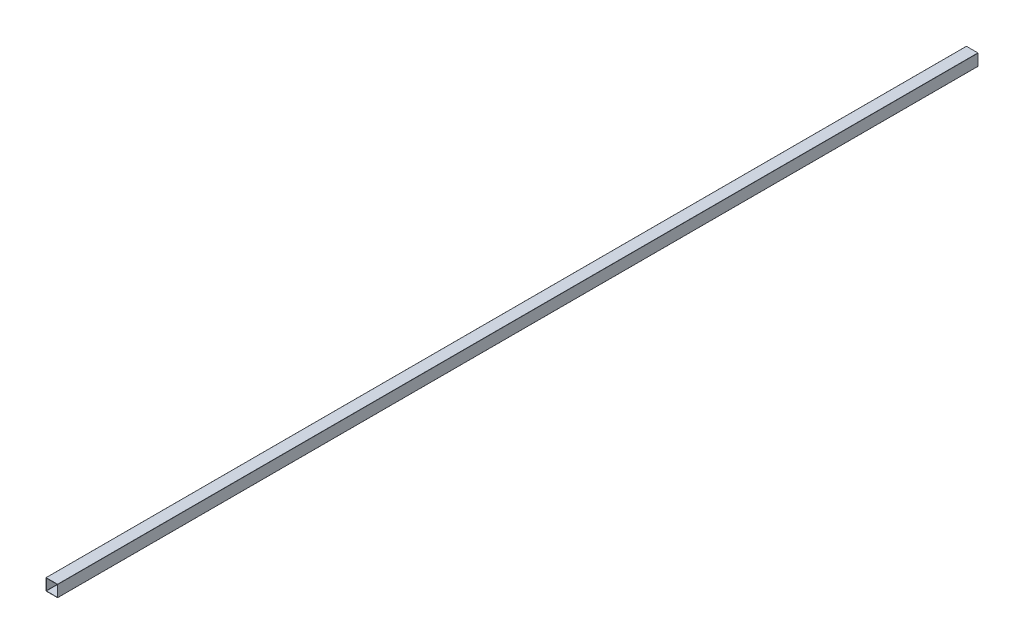
from build123d import *

# Parameters (mm, degrees)
CROQUIS1_W              = 76.2
CROQUIS1_H              = 76.2
CROQUIS1_W_2            = 72.42
CROQUIS1_H_2            = 72.42
SALIENTE_EXTRUIR1_DEPTH = 6000
REDONDEO1_R             = 1


with BuildPart() as part:
    # Croquis1 → Saliente-Extruir1 (new body)
    with BuildSketch(Plane.XY):
        Rectangle(CROQUIS1_W, CROQUIS1_H)
        Rectangle(CROQUIS1_W_2, CROQUIS1_H_2, mode=Mode.SUBTRACT)
    extrude(amount=-SALIENTE_EXTRUIR1_DEPTH)

    # Redondeo1
    redondeo1_edges = [part.edges().sort_by_distance(p)[0] for p in [
        (36.21, -36.21, -3000),
        (-36.21, -36.21, -3000),
        (-36.21, 36.21, -3000),
        (36.21, 36.21, -3000),
        (38.1, -38.1, -3000),
        (-38.1, -38.1, -3000),
        (-38.1, 38.1, -3000),
        (38.1, 38.1, -3000),
    ]]
    fillet(redondeo1_edges, radius=REDONDEO1_R)


solid = part.part
